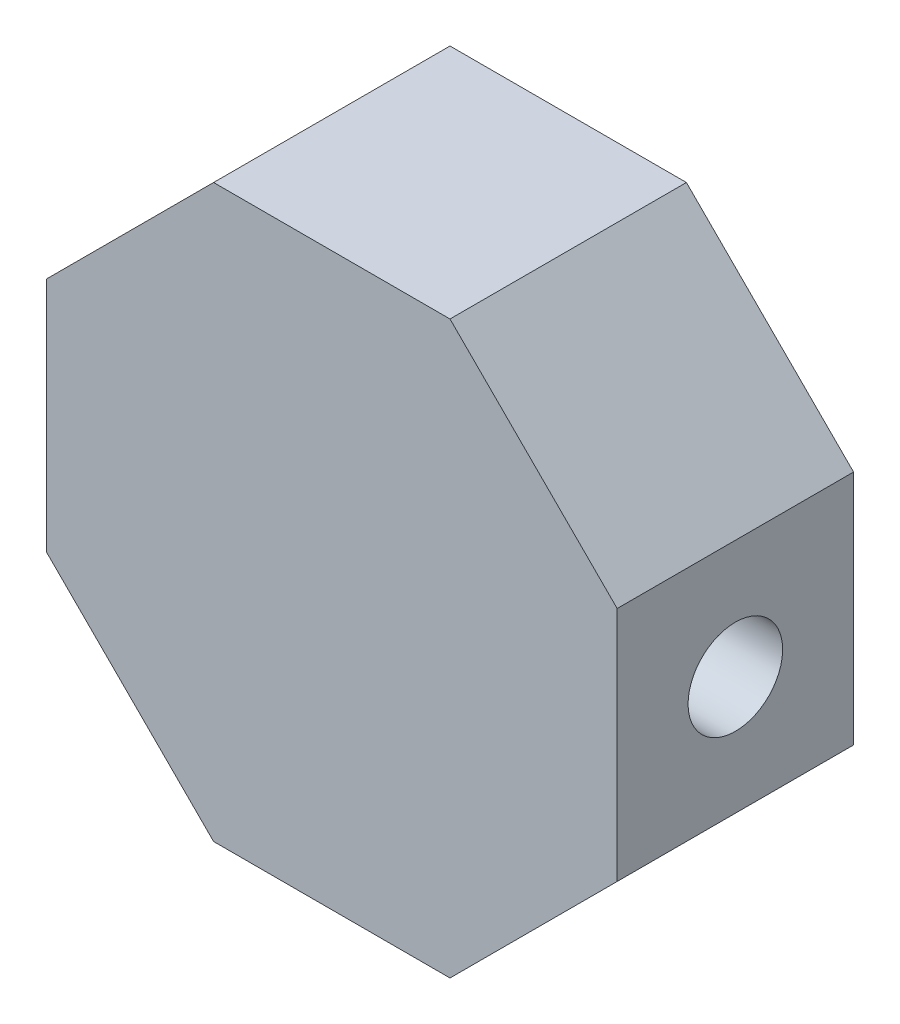
from build123d import *

# Parameters (mm, degrees)
BOSS_EXTRUDE1_DEPTH = 12.7
SKETCH3_R           = 2.54
CUT_EXTRUDE1_DEPTH  = 12.7


with BuildPart() as part:
    # Sketch2 → Boss-Extrude1 (new body)
    with BuildSketch(Plane.XY):
        Polygon((15.330256121, 6.35), (15.330256121, -6.35), (6.35, -15.330256121), (-6.35, -15.330256121), (-15.330256121, -6.35), (-15.330256121, 6.35), (-6.35, 15.330256121), (6.35, 15.330256121), align=None)
    extrude(amount=BOSS_EXTRUDE1_DEPTH)

    # Sketch3 → Cut-Extrude1 (cut)
    with BuildSketch(Plane(origin=(15.330256121, 0, 0), x_dir=(0, 0, -1), z_dir=(1, 0, 0))):
        with Locations(Location((-6.35, 0, 0), (0, 0, 90))):
            Circle(SKETCH3_R)
    extrude(amount=-CUT_EXTRUDE1_DEPTH, mode=Mode.SUBTRACT)


solid = part.part
